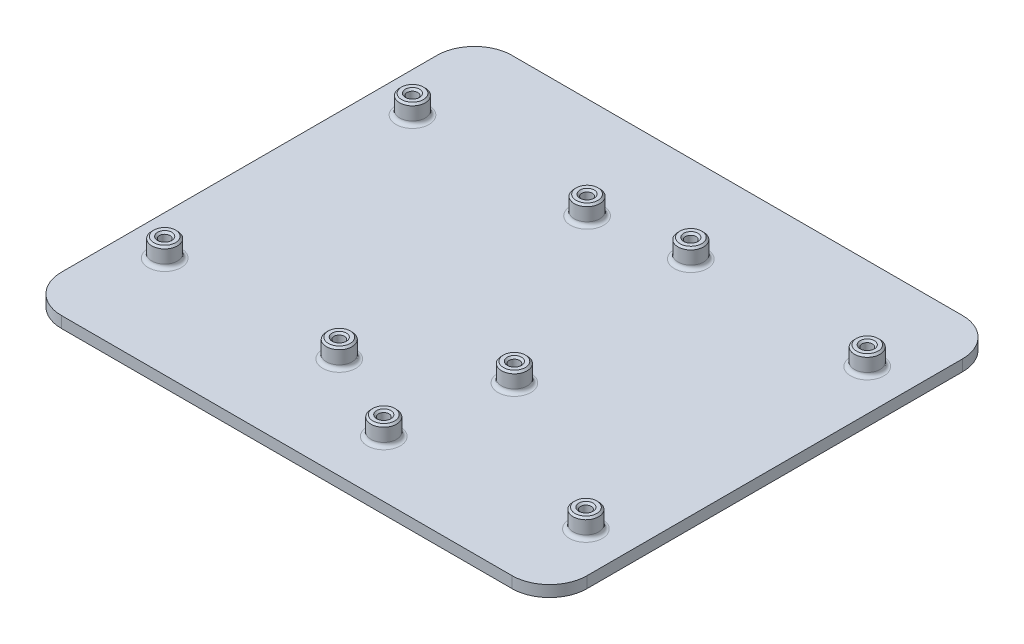
from build123d import *

# Parameters (mm, degrees)
BOSS_EXTRUDE1_DEPTH = 3
SKETCH1_5_R         = 3.4
SKETCH1_5_R_2       = 1.4
BOSS_EXTRUDE2_DEPTH = 5
CHAMFER1_SIZE       = 0.5
FILLET1_R           = 1


with BuildPart() as part:
    # Sketch1 → Boss-Extrude1 (new body)
    with BuildSketch(Plane(origin=(0, 0, 0), x_dir=(1, 0, 0), z_dir=(0, 1, 0))):
        with BuildLine():
            Line((60, 60), (-60, 60))
            ThreePointArc((-60, 60), (-67.071067812, 57.071067812), (-70, 50))
            Line((-70, 50), (-70, -50))
            ThreePointArc((-70, -50), (-67.071067812, -57.071067812), (-60, -60))
            Line((-60, -60), (60, -60))
            ThreePointArc((60, -60), (67.071067812, -57.071067812), (70, -50))
            Line((70, -50), (70, 50))
            ThreePointArc((70, 50), (67.071067812, 57.071067812), (60, 60))
        make_face()
    extrude(amount=-BOSS_EXTRUDE1_DEPTH)

    # Sketch1<5> → Boss-Extrude2 (add)
    # profile 1 of 9: a face of its own
    with BuildSketch(Plane(origin=(0, 0, 0), x_dir=(1, 0, 0), z_dir=(0, 1, 0))):
        with Locations((-59.506062778, 33)):
            Circle(SKETCH1_5_R)
        with Locations((-59.506062778, 33)):
            Circle(SKETCH1_5_R_2, mode=Mode.SUBTRACT)
    # profile 2 of 9: a face of its own
    with BuildSketch(Plane(origin=(0, 0, 0), x_dir=(1, 0, 0), z_dir=(0, 1, 0))):
        with Locations((-13.006062778, 33)):
            Circle(SKETCH1_5_R)
        with Locations((-13.006062778, 33)):
            Circle(SKETCH1_5_R_2, mode=Mode.SUBTRACT)
    # profile 3 of 9: a face of its own
    with BuildSketch(Plane(origin=(0, 0, 0), x_dir=(1, 0, 0), z_dir=(0, 1, 0))):
        with Locations((-13.006062778, -33)):
            Circle(SKETCH1_5_R)
        with Locations((-13.006062778, -33)):
            Circle(SKETCH1_5_R_2, mode=Mode.SUBTRACT)
    # profile 4 of 9: a face of its own
    with BuildSketch(Plane(origin=(0, 0, 0), x_dir=(1, 0, 0), z_dir=(0, 1, 0))):
        with Locations((-59.506062778, -33)):
            Circle(SKETCH1_5_R)
        with Locations((-59.506062778, -33)):
            Circle(SKETCH1_5_R_2, mode=Mode.SUBTRACT)
    # profile 5 of 9: a face of its own
    with BuildSketch(Plane(origin=(0, 0, 0), x_dir=(1, 0, 0), z_dir=(0, 1, 0))):
        with Locations((10.796062778, -44.95)):
            Circle(SKETCH1_5_R)
        with Locations((10.796062778, -44.95)):
            Circle(SKETCH1_5_R_2, mode=Mode.SUBTRACT)
    # profile 6 of 9: a face of its own
    with BuildSketch(Plane(origin=(0, 0, 0), x_dir=(1, 0, 0), z_dir=(0, 1, 0))):
        with Locations((59.056062778, -39.37)):
            Circle(SKETCH1_5_R)
        with Locations((59.056062778, -39.37)):
            Circle(SKETCH1_5_R_2, mode=Mode.SUBTRACT)
    # profile 7 of 9: a face of its own
    with BuildSketch(Plane(origin=(0, 0, 0), x_dir=(1, 0, 0), z_dir=(0, 1, 0))):
        with Locations((15.876062778, -15.24)):
            Circle(SKETCH1_5_R)
        with Locations((15.876062778, -15.24)):
            Circle(SKETCH1_5_R_2, mode=Mode.SUBTRACT)
    # profile 8 of 9: a face of its own
    with BuildSketch(Plane(origin=(0, 0, 0), x_dir=(1, 0, 0), z_dir=(0, 1, 0))):
        with Locations((10.796062778, 36.83)):
            Circle(SKETCH1_5_R)
        with Locations((10.796062778, 36.83)):
            Circle(SKETCH1_5_R_2, mode=Mode.SUBTRACT)
    # profile 9 of 9: a face of its own
    with BuildSketch(Plane(origin=(0, 0, 0), x_dir=(1, 0, 0), z_dir=(0, 1, 0))):
        with Locations((59.056062778, 35.56)):
            Circle(SKETCH1_5_R)
        with Locations((59.056062778, 35.56)):
            Circle(SKETCH1_5_R_2, mode=Mode.SUBTRACT)
    extrude(amount=BOSS_EXTRUDE2_DEPTH)

    # Chamfer1
    chamfer1_edges = [part.edges().sort_by_distance(p)[0] for p in [
        (-62.906062778, 5, 33),
        (-60.906062778, 5, 33),
        (-16.406062778, 5, 33),
        (-14.406062778, 5, 33),
        (12.476062778, 5, 15.24),
        (14.476062778, 5, 15.24),
        (7.396062778, 5, 44.95),
        (9.396062778, 5, 44.95),
        (55.656062778, 5, 39.37),
        (57.656062778, 5, 39.37),
        (55.656062778, 5, -35.56),
        (57.656062778, 5, -35.56),
        (7.396062778, 5, -36.83),
        (9.396062778, 5, -36.83),
        (-16.406062778, 5, -33),
        (-14.406062778, 5, -33),
        (-62.906062778, 5, -33),
        (-60.906062778, 5, -33),
    ]]
    chamfer(chamfer1_edges, length=CHAMFER1_SIZE)

    # Fillet1
    fillet1_edges = [part.edges().sort_by_distance(p)[0] for p in [
        (-62.906062778, 0, -33),
        (-16.406062778, 0, -33),
        (7.396062778, 0, -36.83),
        (55.656062778, 0, -35.56),
        (55.656062778, 0, 39.37),
        (12.476062778, 0, 15.24),
        (7.396062778, 0, 44.95),
        (-16.406062778, 0, 33),
        (-62.906062778, 0, 33),
    ]]
    fillet(fillet1_edges, radius=FILLET1_R)


solid = part.part
